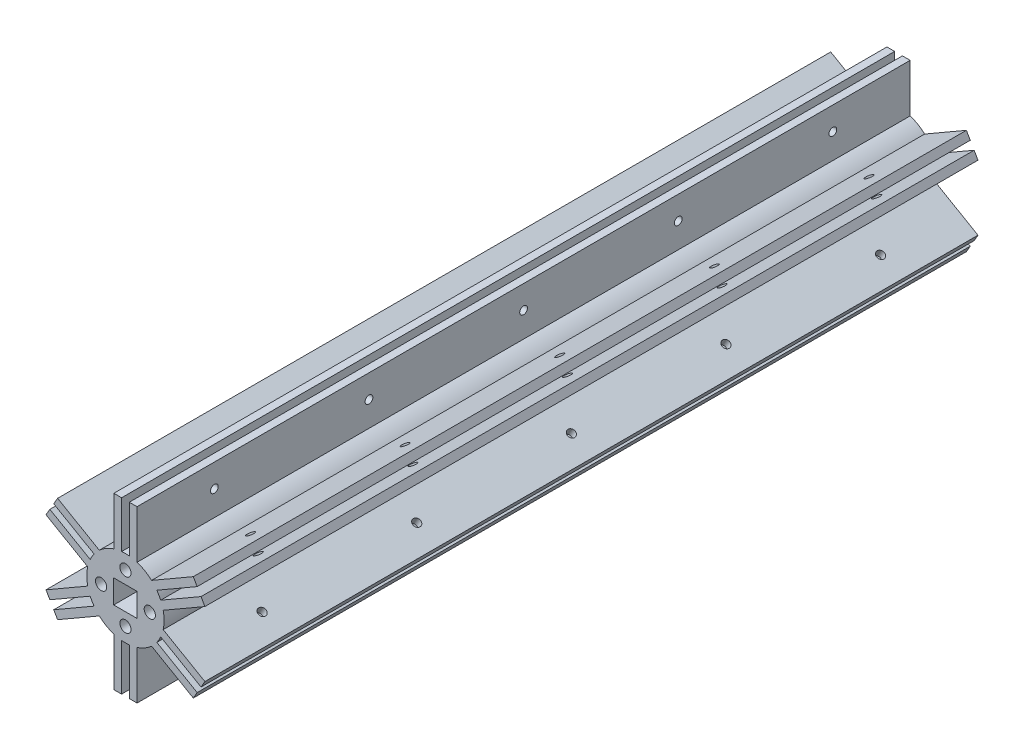
from build123d import *

# Parameters (mm, degrees)
SKETCH1_R           = 10
BOSS_EXTRUDE1_DEPTH = 100
SKETCH4_W           = 2
SKETCH4_H           = 22
BOSS_EXTRUDE3_DEPTH = 200
CIRPATTERN7_COUNT   = 6
SKETCH7_R           = 1
CUT_EXTRUDE2_DEPTH  = 10
CIRPATTERN9_COUNT   = 6
CUT_EXTRUDE3_REACH  = 204.253
SKETCH8_W           = 6.075
SKETCH8_H           = 6.075
SKETCH9_R           = 1.45
CUT_EXTRUDE4_DEPTH  = 10


with BuildPart() as part:
    # Sketch1 → Boss-Extrude1 (new, symmetric)
    with BuildSketch(Plane.XY):
        Circle(SKETCH1_R)
    extrude(amount=BOSS_EXTRUDE1_DEPTH, both=True)

    # Sketch4 → Boss-Extrude3 (add)
    with BuildSketch(Plane.XY.offset(100)):
        with Locations((-2, 11)):
            Rectangle(SKETCH4_W, SKETCH4_H)
        with Locations((2, 11)):
            Rectangle(SKETCH4_W, SKETCH4_H)
    boss_extrude3 = extrude(amount=-BOSS_EXTRUDE3_DEPTH)

    # CirPattern7: Boss-Extrude3 ×6 about axis
    cirpattern7_axis = Axis((0, 0, 0), (0, 0, 1))
    for i in range(1, CIRPATTERN7_COUNT):
        add(boss_extrude3.rotate(cirpattern7_axis, i * 360 / CIRPATTERN7_COUNT))

    # Sketch7 → Cut-Extrude2 (cut)
    with BuildSketch(Plane.ZY.offset(3)):
        with Locations((-80, 16)):
            Circle(SKETCH7_R)
        with Locations((-40, 16)):
            Circle(SKETCH7_R)
        with Locations((0, 16)):
            Circle(SKETCH7_R)
        with Locations((40, 16)):
            Circle(SKETCH7_R)
        with Locations((80, 16)):
            Circle(SKETCH7_R)
    cut_extrude2 = extrude(amount=-CUT_EXTRUDE2_DEPTH, mode=Mode.SUBTRACT)

    # CirPattern9: Cut-Extrude2 ×6 about axis
    cirpattern9_axis = Axis((0, 0, 100), (0, 0, 1))
    for i in range(1, CIRPATTERN9_COUNT):
        add(cut_extrude2.rotate(cirpattern9_axis, i * 360 / CIRPATTERN9_COUNT), mode=Mode.SUBTRACT)

    # Sketch8 → Cut-Extrude3 (cut, up to next)
    with BuildSketch(Plane.XY.offset(100), mode=Mode.PRIVATE) as cut_extrude3_sk1:
        Rectangle(SKETCH8_W, SKETCH8_H)
    cut_extrude3_tool1 = extrude(cut_extrude3_sk1.sketch, amount=-CUT_EXTRUDE3_REACH, mode=Mode.PRIVATE) & part.part
    add(cut_extrude3_tool1.solids().sort_by_distance((0, 0, 100))[0], mode=Mode.SUBTRACT)

    # Sketch9 → Cut-Extrude4 (cut)
    with BuildSketch(Plane.XY.offset(100)):
        with Locations((6.3, 0)):
            Circle(SKETCH9_R)
        with Locations((0, -6.3)):
            Circle(SKETCH9_R)
        with Locations((-6.3, 0)):
            Circle(SKETCH9_R)
        with Locations((0, 6.3)):
            Circle(SKETCH9_R)
    extrude(amount=-CUT_EXTRUDE4_DEPTH, mode=Mode.SUBTRACT)


solid = part.part
